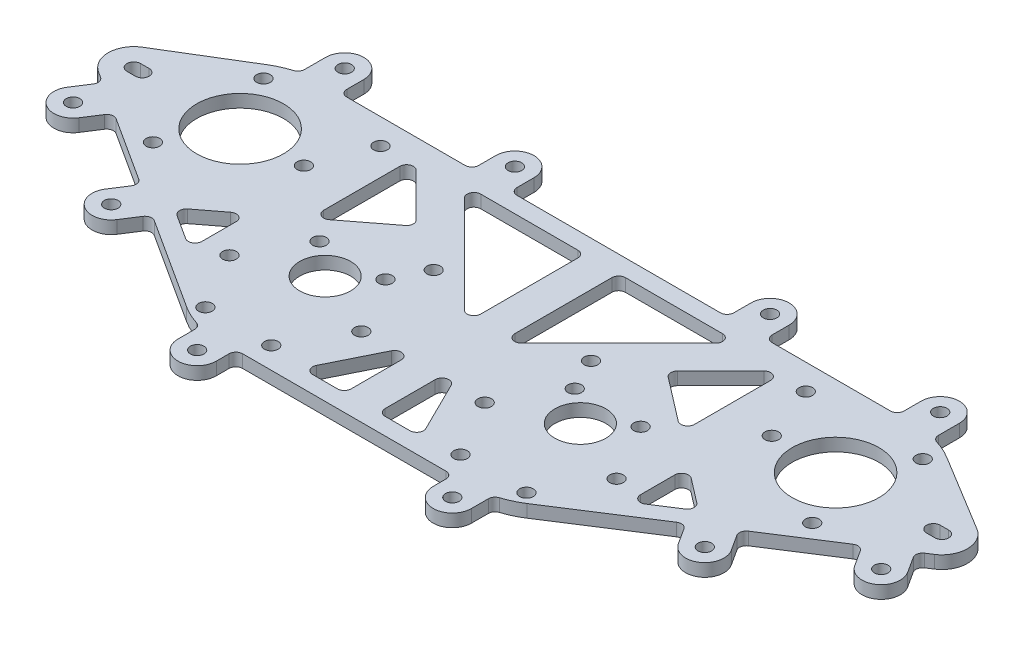
from build123d import *

# Parameters (mm, degrees)
SKETCH_1_R      = 1.6
SKETCH_1_R_2    = 6
SKETCH_1_R_3    = 10.2
EXTRUDE_1_DEPTH = 3
FILLET_1_R      = 1.6


with BuildPart() as part:
    # 草图1 → 凸台-拉伸1 (new body)
    with BuildSketch(Plane(origin=(0, 0, 0), x_dir=(1, 0, 0), z_dir=(0, 1, 0))):
        with BuildLine():
            Line((-104.5, 44.6), (-104.5, 38.459414942))
            ThreePointArc((-104.5, 38.459414942), (-107.275961136, 37.551649197), (-109.88, 36.229158943))
            Line((-109.88, 36.229158943), (-128.12, 25.124997561))
            ThreePointArc((-128.12, 25.124997561), (-130.999516523, 20.076167551), (-128.249103426, 14.955862123))
            Line((-128.249103426, 14.955862123), (-125.533999982, 13.206970217))
            Line((-125.533999982, 13.206970217), (-128.783103408, 8.16283234))
            ThreePointArc((-128.783103408, 8.16283234), (-127.43682757, 1.942901362), (-121.216896592, 3.289177201))
            Line((-121.216896592, 3.289177201), (-117.967793166, 8.333315078))
            Line((-117.967793166, 8.333315078), (-100.313310595, -3.038546913))
            Line((-100.313310595, -3.038546913), (-103.562414021, -8.08268479))
            ThreePointArc((-103.562414021, -8.08268479), (-102.216138182, -14.302615768), (-95.996207205, -12.956339929))
            Line((-95.996207205, -12.956339929), (-92.747103778, -7.912202052))
            Line((-92.747103778, -7.912202052), (-70.018068897, -22.552758456))
            ThreePointArc((-70.018068897, -22.552758456), (-67.356868814, -23.974288829), (-64.5, -24.944358445))
            Line((-64.5, -24.944358445), (-64.5, -30.1))
            ThreePointArc((-64.5, -30.1), (-60, -34.6), (-55.5, -30.1))
            Line((-55.5, -30.1), (-55.5, -25.5))
            Line((-55.5, -25.5), (-4.5, -25.5))
            Line((-4.5, -25.5), (-4.5, -30.1))
            ThreePointArc((-4.5, -30.1), (0, -34.6), (4.5, -30.1))
            Line((4.5, -30.1), (4.5, -24.944358445))
            ThreePointArc((4.5, -24.944358445), (7.356868814, -23.974288829), (10.018068897, -22.552758456))
            Line((10.018068897, -22.552758456), (32.747103778, -7.912202052))
            Line((32.747103778, -7.912202052), (35.996207205, -12.956339929))
            ThreePointArc((35.996207205, -12.956339929), (42.216138182, -14.302615768), (43.562414021, -8.08268479))
            Line((43.562414021, -8.08268479), (40.313310595, -3.038546913))
            Line((40.313310595, -3.038546913), (57.967793166, 8.333315078))
            Line((57.967793166, 8.333315078), (61.216896592, 3.289177201))
            ThreePointArc((61.216896592, 3.289177201), (67.43682757, 1.942901362), (68.783103408, 8.16283234))
            Line((68.783103408, 8.16283234), (65.533999982, 13.206970217))
            Line((65.533999982, 13.206970217), (68.249103426, 14.955862123))
            ThreePointArc((68.249103426, 14.955862123), (70.999516523, 20.076167551), (68.12, 25.124997561))
            Line((68.12, 25.124997561), (49.88, 36.229158943))
            ThreePointArc((49.88, 36.229158943), (47.275961136, 37.551649197), (44.5, 38.459414942))
            Line((44.5, 38.459414942), (44.5, 44.6))
            ThreePointArc((44.5, 44.6), (40, 49.1), (35.5, 44.6))
            Line((35.5, 44.6), (35.5, 39))
            Line((35.5, 39), (4.5, 39))
            Line((4.5, 39), (4.5, 44.6))
            ThreePointArc((4.5, 44.6), (0, 49.1), (-4.5, 44.6))
            Line((-4.5, 44.6), (-4.5, 39))
            Line((-4.5, 39), (-55.5, 39))
            Line((-55.5, 39), (-55.5, 44.6))
            ThreePointArc((-55.5, 44.6), (-60, 49.1), (-64.5, 44.6))
            Line((-64.5, 44.6), (-64.5, 39))
            Line((-64.5, 39), (-95.5, 39))
            Line((-95.5, 39), (-95.5, 44.6))
            ThreePointArc((-95.5, 44.6), (-100, 49.1), (-104.5, 44.6))
        make_face()
        with Locations(Location((-60, -30.1, 0), (0, 0, 270))):
            Circle(SKETCH_1_R, mode=Mode.SUBTRACT)
        with Locations(Location((-67.75, -20.423393759, 0), (0, 0, 270))):
            Circle(SKETCH_1_R, mode=Mode.SUBTRACT)
        with Locations(Location((-52.25, -20.423393759, 0), (0, 0, 270))):
            Circle(SKETCH_1_R, mode=Mode.SUBTRACT)
        with Locations(Location((-99.779310613, -10.51951236, 0), (0, 0, 270))):
            Circle(SKETCH_1_R, mode=Mode.SUBTRACT)
        Polygon((-91.65080848, -3.860365309), (-81.562532725, 3.885079428), (-81.562532725, -10.358572161), align=None, mode=Mode.SUBTRACT)
        with Locations(Location((-125, 5.726004771, 0), (0, 0, 270))):
            Circle(SKETCH_1_R, mode=Mode.SUBTRACT)
        with Locations(Location((-107.5, 7.009618943, 0), (0, 0, 270))):
            Circle(SKETCH_1_R, mode=Mode.SUBTRACT)
        with Locations(Location((-75.5, -7, 0), (0, 0, 270))):
            Circle(SKETCH_1_R, mode=Mode.SUBTRACT)
        Polygon((-44, -21.5), (-34, -1.284271247), (-34, -21.5), align=None, mode=Mode.SUBTRACT)
        with Locations(Location((-44.5, -7, 0), (0, 0, 270))):
            Circle(SKETCH_1_R, mode=Mode.SUBTRACT)
        with Locations(Location((-60, 0, 0), (0, 0, 270))):
            Circle(SKETCH_1_R_2, mode=Mode.SUBTRACT)
        with Locations(Location((-67.75, 6.423393759, 0), (0, 0, 270))):
            Circle(SKETCH_1_R, mode=Mode.SUBTRACT)
        with Locations(Location((-52.25, 6.423393759, 0), (0, 0, 270))):
            Circle(SKETCH_1_R, mode=Mode.SUBTRACT)
        with Locations(Location((-7.75, -20.423393759, 0), (0, 0, 270))):
            Circle(SKETCH_1_R, mode=Mode.SUBTRACT)
        with Locations(Location((7.75, -20.423393759, 0), (0, 0, 270))):
            Circle(SKETCH_1_R, mode=Mode.SUBTRACT)
        Polygon((-16, -21.5), (-26, -21.5), (-26, -1.284271247), align=None, mode=Mode.SUBTRACT)
        with Locations(Location((-15.5, -7, 0), (0, 0, 270))):
            Circle(SKETCH_1_R, mode=Mode.SUBTRACT)
        with Locations(Location((15.5, -7, 0), (0, 0, 270))):
            Circle(SKETCH_1_R, mode=Mode.SUBTRACT)
        with Locations(Location((-7.75, 6.423393759, 0), (0, 0, 270))):
            Circle(SKETCH_1_R, mode=Mode.SUBTRACT)
        with Locations(Location((0, 0, 0), (0, 0, 270))):
            Circle(SKETCH_1_R_2, mode=Mode.SUBTRACT)
        with Locations(Location((7.75, 6.423393759, 0), (0, 0, 270))):
            Circle(SKETCH_1_R, mode=Mode.SUBTRACT)
        with Locations(Location((39.779310613, -10.51951236, 0), (0, 0, 270))):
            Circle(SKETCH_1_R, mode=Mode.SUBTRACT)
        Polygon((21.562532725, 3.885079428), (31.65080848, -3.860365309), (21.562532725, -10.358572161), align=None, mode=Mode.SUBTRACT)
        with Locations(Location((47.5, 7.009618943, 0), (0, 0, 270))):
            Circle(SKETCH_1_R, mode=Mode.SUBTRACT)
        with Locations(Location((65, 5.726004771, 0), (0, 0, 270))):
            Circle(SKETCH_1_R, mode=Mode.SUBTRACT)
        with BuildLine():
            ThreePointArc((-123, 21.6), (-121.4, 20), (-123, 18.4))
            Line((-123, 18.4), (-125, 18.4))
            ThreePointArc((-125, 18.4), (-126.6, 20), (-125, 21.6))
            Line((-125, 21.6), (-123, 21.6))
        make_face(mode=Mode.SUBTRACT)
        with Locations(Location((-100, 20, 0), (0, 0, 270))):
            Circle(SKETCH_1_R_3, mode=Mode.SUBTRACT)
        with Locations(Location((-85, 20, 0), (0, 0, 270))):
            Circle(SKETCH_1_R, mode=Mode.SUBTRACT)
        with Locations(Location((-48.5, 14, 0), (0, 0, 270))):
            Circle(SKETCH_1_R, mode=Mode.SUBTRACT)
        Polygon((-73.597979746, 10), (-73.597979746, 35), (-59.455844123, 20.857864376), align=None, mode=Mode.SUBTRACT)
        Polygon((-34, 6.715728753), (-41.284271247, 14), (-62.284271247, 35), (-34, 35), (-34, 14), align=None, mode=Mode.SUBTRACT)
        with Locations(Location((-107.5, 32.990381057, 0), (0, 0, 270))):
            Circle(SKETCH_1_R, mode=Mode.SUBTRACT)
        with Locations(Location((-80, 33, 0), (0, 0, 270))):
            Circle(SKETCH_1_R, mode=Mode.SUBTRACT)
        with Locations(Location((-100, 44.6, 0), (0, 0, 270))):
            Circle(SKETCH_1_R, mode=Mode.SUBTRACT)
        with Locations(Location((-60, 44.6, 0), (0, 0, 270))):
            Circle(SKETCH_1_R, mode=Mode.SUBTRACT)
        with Locations(Location((-11.5, 14, 0), (0, 0, 270))):
            Circle(SKETCH_1_R, mode=Mode.SUBTRACT)
        Polygon((-26, 6.715728753), (-26, 14), (-26, 35), (2.284271247, 35), (-18.715728753, 14), align=None, mode=Mode.SUBTRACT)
        Polygon((13.597979746, 35), (13.597979746, 10), (-0.544155877, 20.857864376), align=None, mode=Mode.SUBTRACT)
        with Locations(Location((25, 20, 0), (0, 0, 270))):
            Circle(SKETCH_1_R, mode=Mode.SUBTRACT)
        with Locations(Location((40, 20, 0), (0, 0, 270))):
            Circle(SKETCH_1_R_3, mode=Mode.SUBTRACT)
        with BuildLine():
            Line((65, 18.4), (63, 18.4))
            ThreePointArc((63, 18.4), (61.4, 20), (63, 21.6))
            Line((63, 21.6), (65, 21.6))
            ThreePointArc((65, 21.6), (66.6, 20), (65, 18.4))
        make_face(mode=Mode.SUBTRACT)
        with Locations(Location((0, 44.6, 0), (0, 0, 270))):
            Circle(SKETCH_1_R, mode=Mode.SUBTRACT)
        with Locations(Location((20, 33, 0), (0, 0, 270))):
            Circle(SKETCH_1_R, mode=Mode.SUBTRACT)
        with Locations(Location((47.5, 32.990381057, 0), (0, 0, 270))):
            Circle(SKETCH_1_R, mode=Mode.SUBTRACT)
        with Locations(Location((40, 44.6, 0), (0, 0, 270))):
            Circle(SKETCH_1_R, mode=Mode.SUBTRACT)
        with Locations(Location((0, -30.1, 0), (0, 0, 270))):
            Circle(SKETCH_1_R, mode=Mode.SUBTRACT)
    extrude(amount=EXTRUDE_1_DEPTH)

    # 圆角1
    fillet_1_edges = [part.edges().sort_by_distance(p)[0] for p in [
        (-26, 1.5, 1.284271247),
        (-26, 1.5, 21.5),
        (-16, 1.5, 21.5),
        (-81.562532725, 1.5, -3.885079428),
        (-91.65080848, 1.5, 3.860365309),
        (-81.562532725, 1.5, 10.358572161),
        (-73.597979746, 1.5, -35),
        (-73.597979746, 1.5, -10),
        (-59.455844123, 1.5, -20.857864376),
        (31.65080848, 1.5, 3.860365309),
        (21.562532725, 1.5, -3.885079428),
        (21.562532725, 1.5, 10.358572161),
        (13.597979746, 1.5, -10),
        (13.597979746, 1.5, -35),
        (-0.544155877, 1.5, -20.857864376),
        (-34, 1.5, 21.5),
        (-34, 1.5, 1.284271247),
        (-44, 1.5, 21.5),
        (-34, 1.5, -6.715728753),
        (-34, 1.5, -35),
        (-62.284271247, 1.5, -35),
        (-26, 1.5, -6.715728753),
        (2.284271247, 1.5, -35),
        (-26, 1.5, -35),
        (65.533999982, 1.5, -13.206970217),
        (57.967793166, 1.5, -8.333315078),
        (40.313310595, 1.5, 3.038546913),
        (32.747103778, 1.5, 7.912202052),
        (4.5, 1.5, 24.944358445),
        (-4.5, 1.5, 25.5),
        (-55.5, 1.5, 25.5),
        (-64.5, 1.5, 24.944358445),
        (-92.747103778, 1.5, 7.912202052),
        (-100.313310595, 1.5, 3.038546913),
        (-117.967793166, 1.5, -8.333315078),
        (-125.533999982, 1.5, -13.206970217),
        (-104.5, 1.5, -38.459414942),
        (-95.5, 1.5, -39),
        (-64.5, 1.5, -39),
        (-55.5, 1.5, -39),
        (-4.5, 1.5, -39),
        (4.5, 1.5, -39),
        (35.5, 1.5, -39),
        (44.5, 1.5, -38.459414942),
    ]]
    fillet(fillet_1_edges, radius=FILLET_1_R)


solid = part.part
